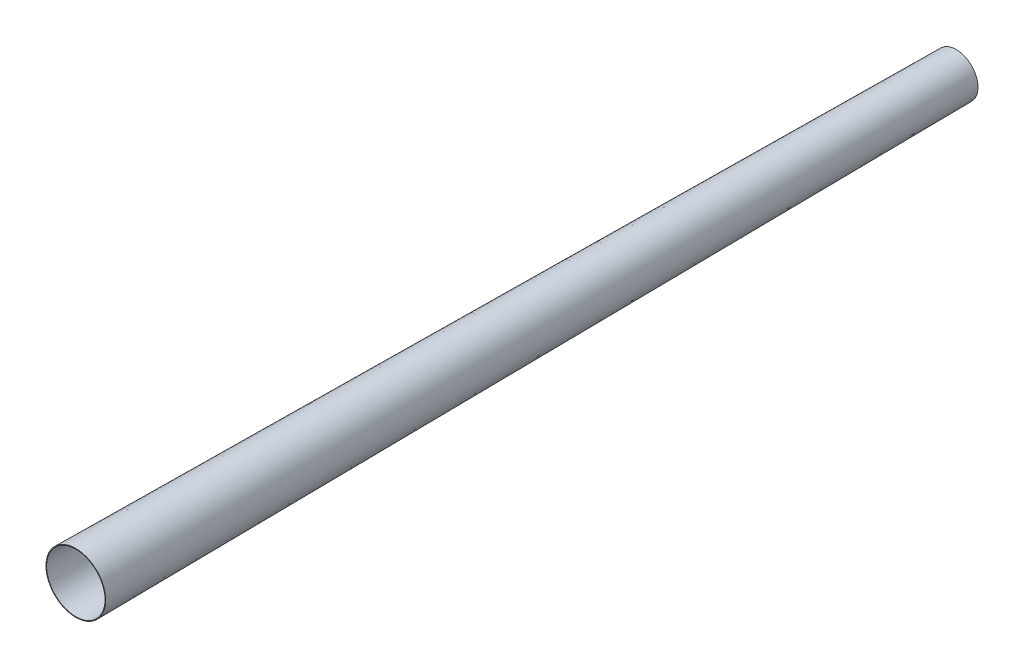
from build123d import *

# Parameters (mm, degrees)
SKETCH1_R = 17.366136035
SKETCH2_R = 23.77506719
SHELL1_T  = -0.5


with BuildPart() as part:
    # Sketch1 → Loft1 section 0
    with BuildSketch(Plane.XY):
        Circle(SKETCH1_R)
    # Sketch2 → Loft1 section 1
    with BuildSketch(Plane.XY.offset(700.99461252)):
        Circle(SKETCH2_R)
    loft()

    # Shell1
    shell1_openings = [part.faces().sort_by_distance(p)[0] for p in [
        (0, 0, 700.99461252),
        (0, 0, 0),
    ]]
    offset(amount=SHELL1_T, openings=shell1_openings, kind=Kind.INTERSECTION)


solid = part.part
